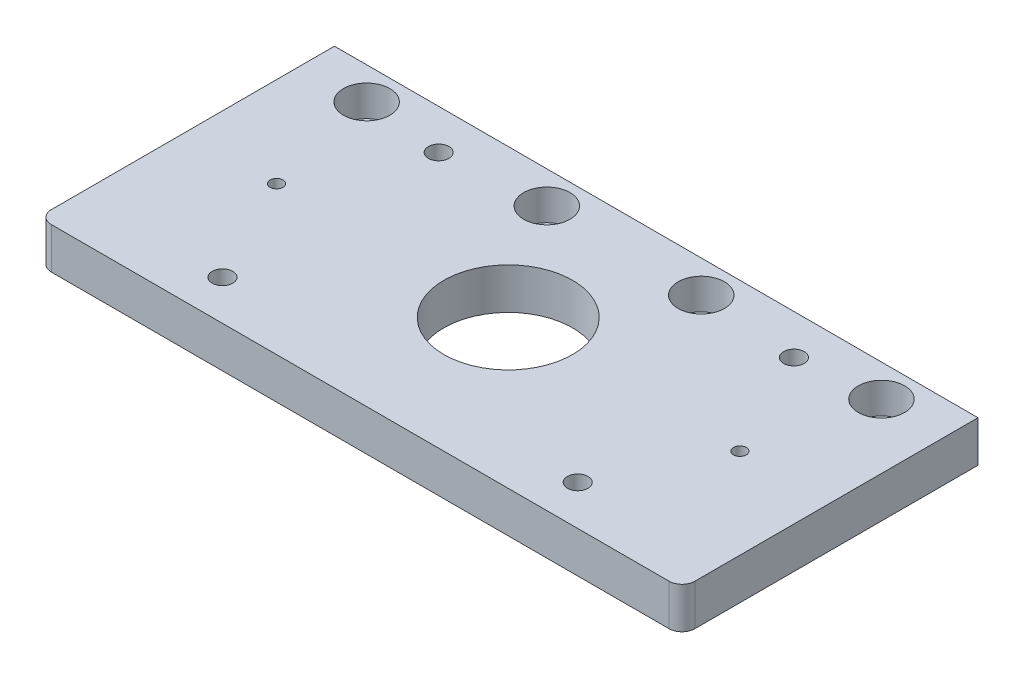
from build123d import *

# Parameters (mm, degrees)
SKETCH_1_R          = 25
SKETCH_1_R_2        = 4
SKETCH_1_R_3        = 6
EXTRUDE_1_DEPTH     = 16
SKETCH_2_R          = 9
CUT_EXTRUDE_1_DEPTH = 12
SKETCH_3_R          = 2.5
CUT_EXTRUDE_2_DEPTH = 41
SKETCH_4_R          = 12.5
CUT_EXTRUDE_3_DEPTH = 12


with BuildPart() as part:
    # 草图1 → 凸台-拉伸1 (new body)
    with BuildSketch(Plane(origin=(0, 0, 0), x_dir=(1, 0, 0), z_dir=(0, 1, 0))):
        with BuildLine():
            Line((-125, 57.5), (125, 57.5))
            Line((125, 57.5), (125, -52.5))
            ThreePointArc((125, -52.5), (123.535533906, -56.035533906), (120, -57.5))
            Line((120, -57.5), (-120, -57.5))
            ThreePointArc((-120, -57.5), (-123.535533906, -56.035533906), (-125, -52.5))
            Line((-125, -52.5), (-125, 57.5))
        make_face()
        with Locations(Location((0, 0, 0), (0, 0, 270))):
            Circle(SKETCH_1_R, mode=Mode.SUBTRACT)
        with Locations(Location((69, -42, 0), (0, 0, 270))):
            Circle(SKETCH_1_R_2, mode=Mode.SUBTRACT)
        with Locations(Location((69, 42, 0), (0, 0, 90))):
            Circle(SKETCH_1_R_2, mode=Mode.SUBTRACT)
        with Locations(Location((-69, -42, 0), (0, 0, 90))):
            Circle(SKETCH_1_R_2, mode=Mode.SUBTRACT)
        with Locations(Location((-69, 42, 0), (0, 0, 270))):
            Circle(SKETCH_1_R_2, mode=Mode.SUBTRACT)
        with Locations(Location((30, 45, 0), (0, 0, 270))):
            Circle(SKETCH_1_R_3, mode=Mode.SUBTRACT)
        with Locations(Location((100, 45, 0), (0, 0, 270))):
            Circle(SKETCH_1_R_3, mode=Mode.SUBTRACT)
        with Locations(Location((-100, 45, 0), (0, 0, 90))):
            Circle(SKETCH_1_R_3, mode=Mode.SUBTRACT)
        with Locations(Location((-30, 45, 0), (0, 0, 90))):
            Circle(SKETCH_1_R_3, mode=Mode.SUBTRACT)
    extrude(amount=EXTRUDE_1_DEPTH)

    # 草图2 → 切除-拉伸1 (cut)
    with BuildSketch(Plane(origin=(0, 16, 0), x_dir=(1, 0, 0), z_dir=(0, 1, 0))):
        with Locations(Location((-100, 45, 0), (0, 0, 270))):
            Circle(SKETCH_2_R)
        with Locations(Location((-30, 45, 0), (0, 0, 270))):
            Circle(SKETCH_2_R)
        with Locations(Location((30, 45, 0), (0, 0, 90))):
            Circle(SKETCH_2_R)
        with Locations(Location((100, 45, 0), (0, 0, 90))):
            Circle(SKETCH_2_R)
    extrude(amount=-CUT_EXTRUDE_1_DEPTH, mode=Mode.SUBTRACT)

    # 草图3 → 切除-拉伸2 (cut)
    with BuildSketch(Plane(origin=(0, 16, 0), x_dir=(1, 0, 0), z_dir=(0, 1, 0))):
        with Locations(Location((-90, 0, 0), (0, 0, 270))):
            Circle(SKETCH_3_R)
        with Locations(Location((90, 0, 0), (0, 0, 270))):
            Circle(SKETCH_3_R)
    extrude(amount=-CUT_EXTRUDE_2_DEPTH, mode=Mode.SUBTRACT)

    # 草图4 → 切除-拉伸3 (cut)
    with BuildSketch(Plane.XZ):
        with Locations(Location((-90, 0, 0), (0, 0, 270))):
            Circle(SKETCH_4_R)
        with Locations(Location((90, 0, 0), (0, 0, 270))):
            Circle(SKETCH_4_R)
    extrude(amount=-CUT_EXTRUDE_3_DEPTH, mode=Mode.SUBTRACT)


solid = part.part
